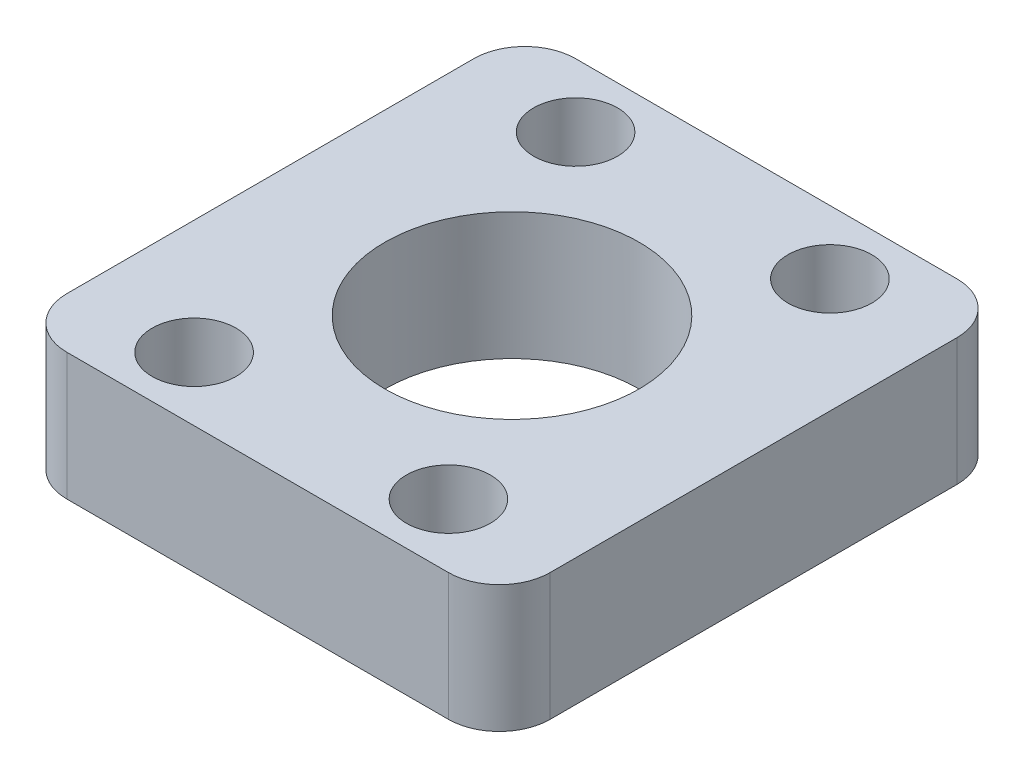
from build123d import *

# Parameters (mm, degrees)
SKETCH_1_W          = 19
SKETCH_1_H          = 20
EXTRUDE_1_DEPTH     = 5
SKETCH_2_R          = 1.65
CUT_EXTRUDE_1_DEPTH = 15.671400751
FILLET_1_R          = 2
SKETCH_3_R          = 5
CUT_EXTRUDE_2_DEPTH = 10


with BuildPart() as part:
    # 草图1 → 凸台-拉伸1 (new body)
    with BuildSketch(Plane(origin=(0, 0, 0), x_dir=(1, 0, 0), z_dir=(0, 1, 0))):
        Rectangle(SKETCH_1_W, SKETCH_1_H)
    extrude(amount=EXTRUDE_1_DEPTH)

    # 草图2 → 切除-拉伸1 (cut, through all)
    with BuildSketch(Plane(origin=(0, 5, 0), x_dir=(1, 0, 0), z_dir=(0, 1, 0))):
        with Locations(Location((-5, 7.5, 0), (0, 0, 270))):
            Circle(SKETCH_2_R)
        with Locations(Location((5, 7.5, 0), (0, 0, 270))):
            Circle(SKETCH_2_R)
        with Locations(Location((5, -7.5, 0), (0, 0, 90))):
            Circle(SKETCH_2_R)
        with Locations(Location((-5, -7.5, 0), (0, 0, 90))):
            Circle(SKETCH_2_R)
    extrude(amount=-CUT_EXTRUDE_1_DEPTH, mode=Mode.SUBTRACT)

    # 圆角1
    fillet_1_edges = [part.edges().sort_by_distance(p)[0] for p in [
        (9.5, 2.5, 10),
        (-9.5, 2.5, 10),
        (-9.5, 2.5, -10),
        (9.5, 2.5, -10),
    ]]
    fillet(fillet_1_edges, radius=FILLET_1_R)

    # 草图3 → 切除-拉伸2 (cut)
    with BuildSketch(Plane(origin=(0, 5, 0), x_dir=(1, 0, 0), z_dir=(0, 1, 0))):
        with Locations(Location((0, 0, 0), (0, 0, 270))):
            Circle(SKETCH_3_R)
    extrude(amount=-CUT_EXTRUDE_2_DEPTH, mode=Mode.SUBTRACT)


solid = part.part
